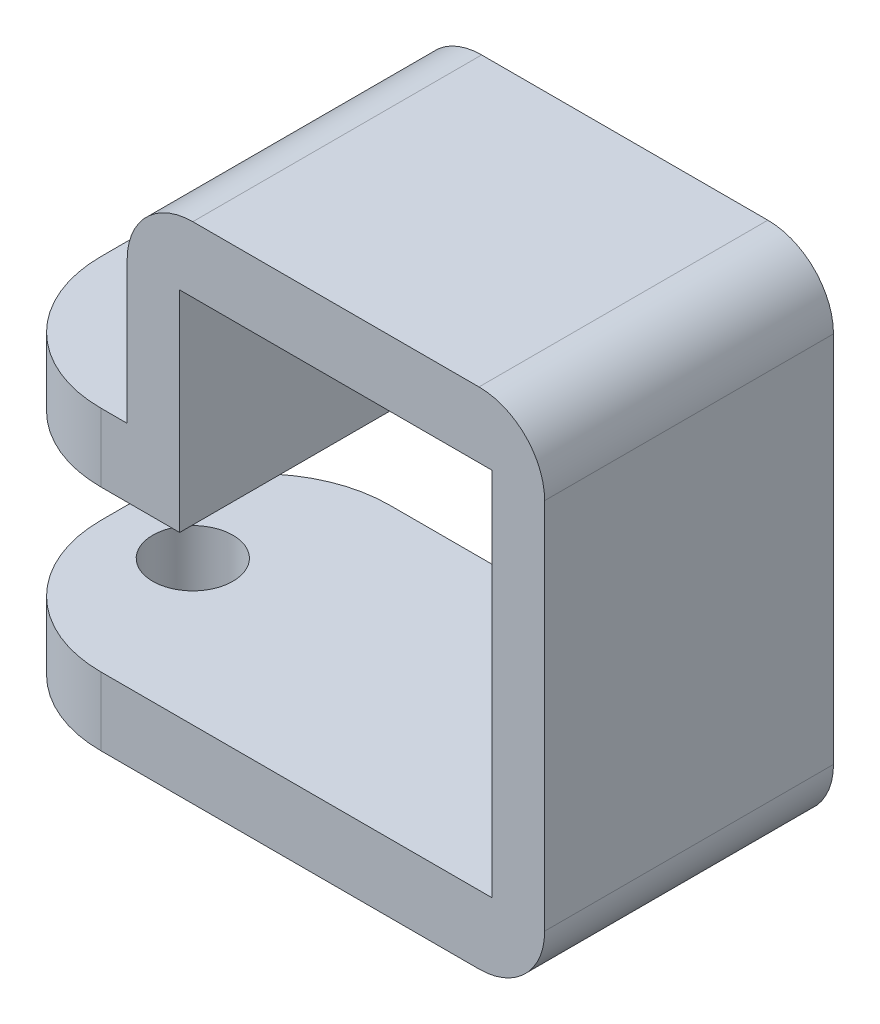
from build123d import *

# Parameters (mm, degrees)
BOSS_EXTRUDE1_DEPTH = 11
FILLET2_R           = 2.5
SKETCH2_R           = 1.525
CUT_EXTRUDE1_DEPTH  = 22.05451258
FILLET3_R           = 5


with BuildPart() as part:
    # Sketch1 → Boss-Extrude1 (new body)
    with BuildSketch(Plane.XY):
        Polygon((-5.95, 0), (-5.95, 8), (5.95, 8), (5.95, 0), (5.95, -6.1), (-13.95, -6.1), (-13.95, -8.7), (7.95, -8.7), (7.95, 2.6), (7.95, 10.5), (-7.95, 10.5), (-7.95, 2.6), (-13.95, 2.6), (-13.95, 0), (-8.65875, 0), align=None)
    extrude(amount=BOSS_EXTRUDE1_DEPTH)

    # Fillet2
    fillet2_edges = [part.edges().sort_by_distance(p)[0] for p in [
        (-7.95, 10.5, 5.5),
        (7.95, 10.5, 5.5),
        (7.95, -8.7, 5.5),
    ]]
    fillet(fillet2_edges, radius=FILLET2_R)

    # Sketch2 → Cut-Extrude1 (cut, through all)
    with BuildSketch(Plane(origin=(0, 2.6, 0), x_dir=(1, 0, 0), z_dir=(0, 1, 0))):
        with Locations(Location((-10.95, -5.5, 0), (0, 0, 180))):
            Circle(SKETCH2_R)
    extrude(amount=-CUT_EXTRUDE1_DEPTH, mode=Mode.SUBTRACT)

    # Fillet3
    fillet3_edges = [part.edges().sort_by_distance(p)[0] for p in [
        (-13.95, 1.3, 0),
        (-13.95, -7.4, 0),
        (-13.95, -7.4, 11),
        (-13.95, 1.3, 11),
    ]]
    fillet(fillet3_edges, radius=FILLET3_R)


solid = part.part
